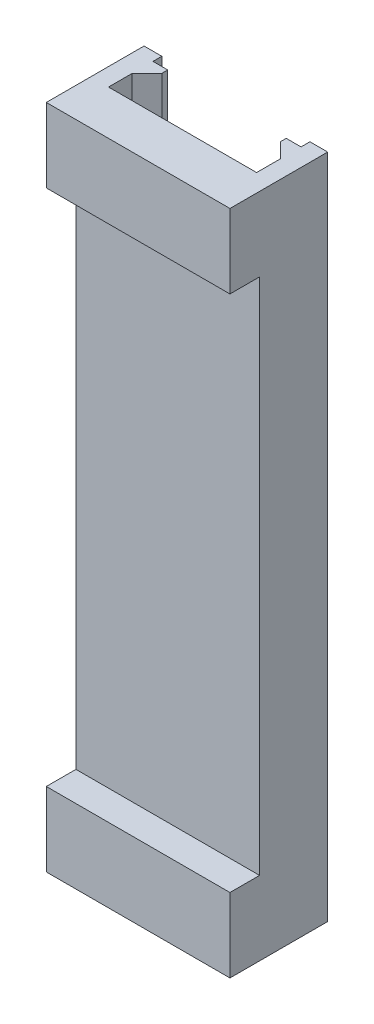
from build123d import *

# Parameters (mm, degrees)
P_IDAT_VYSUNUT_M1_DEPTH = 45
SKICA3_W                = 12.4
SKICA3_H                = 5
P_IDAT_VYSUNUT_M2_DEPTH = 2


with BuildPart() as part:
    # Skica1 → Přidat vysunutím1 (new body)
    with BuildSketch(Plane(origin=(0, 0, 0), x_dir=(1, 0, 0), z_dir=(0, 1, 0))):
        Polygon((-5, 0), (5, 0), (5, 1.6), (4, 2.6), (4, 3), (5, 3), (5, 3.6), (6.2, 3.6), (6.2, -1), (-6.2, -1), (-6.2, 3.6), (-5, 3.6), (-5, 3), (-4, 3), (-4, 2.6), (-5, 1.6), align=None)
    extrude(amount=P_IDAT_VYSUNUT_M1_DEPTH)

    # Skica3 → Přidat vysunutím2 (add)
    with BuildSketch(Plane.XY.offset(1)):
        with Locations((0, 42.5)):
            Rectangle(SKICA3_W, SKICA3_H)
        with Locations((0, 2.5)):
            Rectangle(SKICA3_W, SKICA3_H)
    extrude(amount=P_IDAT_VYSUNUT_M2_DEPTH)


solid = part.part
